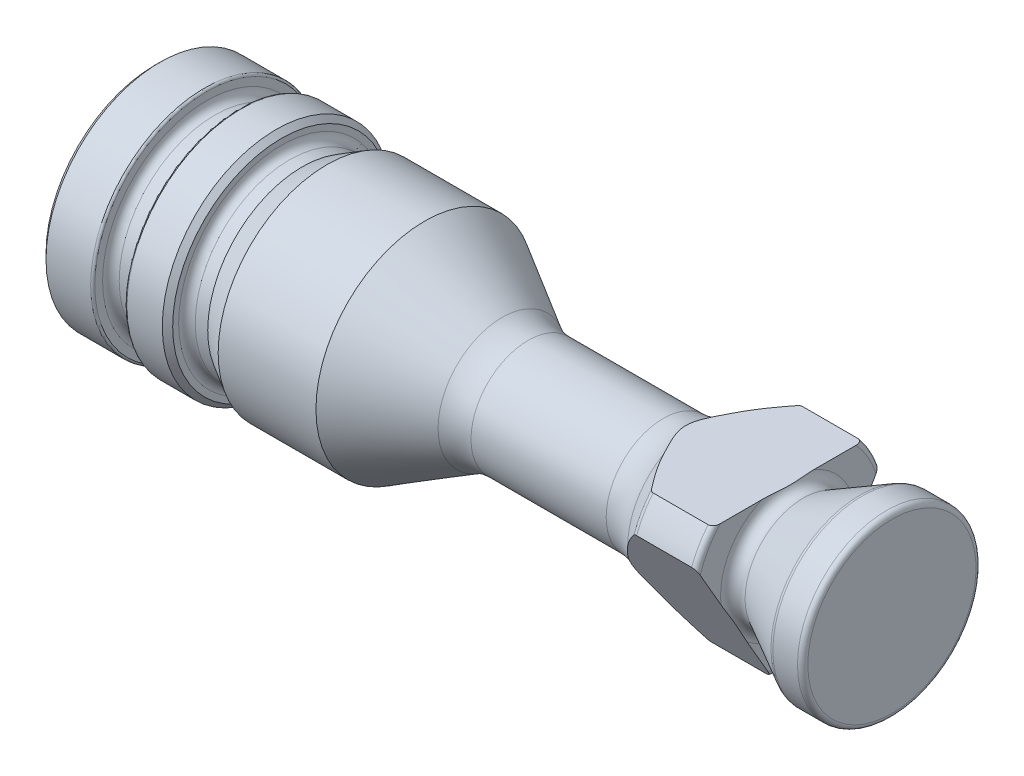
from build123d import *

# Parameters (mm, degrees)
SKETCH2_W          = 10
SKETCH2_H          = 10
CUT_EXTRUDE1_DEPTH = 10
CHAMFER2_SIZE      = 0.5
CHAMFER3_SIZE      = 0.5
SKETCH3_R          = 1.75
CUT_EXTRUDE2_DEPTH = 10
CHAMFER4_SIZE      = 0.5
CUT_EXTRUDE3_DEPTH = 0.01
SKETCH5_W          = 17.172725468
SKETCH5_H          = 6.715014659
CUT_EXTRUDE4_DEPTH = 13
CIRPATTERN1_COUNT  = 3


with BuildPart() as part:
    # Sketch1 → Revolve1 (revolve)
    with BuildSketch(Plane.XY, mode=Mode.PRIVATE) as revolve1_sk:
        with BuildLine():
            Line((33.45669873, 6.169872981), (26, 10.475))
            Line((26, 10.475), (16.58156986, 10.475))
            Line((16.58156986, 10.475), (14.2, 9.1))
            Line((14.2, 9.1), (13, 9.1))
            ThreePointArc((13, 9.1), (12.434314575, 9.334314575), (12.2, 9.9))
            Line((12.2, 9.9), (12.2, 10.975))
            Line((12.2, 10.975), (8.3, 10.975))
            ThreePointArc((8.3, 10.975), (8.158578644, 10.916421356), (8.1, 10.775))
            Line((8.1, 10.775), (8.1, 10.025))
            ThreePointArc((8.1, 10.025), (7.865685425, 9.459314575), (7.3, 9.225))
            Line((7.3, 9.225), (5.8, 9.225))
            ThreePointArc((5.8, 9.225), (5.234314575, 9.459314575), (5, 10.025))
            Line((5, 10.025), (5, 10.775))
            ThreePointArc((5, 10.775), (4.941421356, 10.916421356), (4.8, 10.975))
            Line((4.8, 10.975), (0, 10.975))
            Line((0, 10.975), (0, 0))
            Line((0, 0), (71, 0))
            Line((71, 0), (71, 8.1))
            ThreePointArc((71, 8.1), (70.853553391, 8.453553391), (70.5, 8.6))
            Line((70.5, 8.6), (68.126244748, 8.6))
            ThreePointArc((68.126244748, 8.6), (68.003841388, 8.58478595), (67.888887031, 8.540069669))
            Line((67.888887031, 8.540069669), (62.474715435, 5.619860661))
            ThreePointArc((62.474715435, 5.619860661), (61.487513627, 5.641304642), (61, 6.5))
            Line((61, 6.5), (61, 8.875))
            ThreePointArc((61, 8.875), (60.853553391, 9.228553391), (60.5, 9.375))
            Line((60.5, 9.375), (55.202473207, 9.375))
            ThreePointArc((55.202473207, 9.375), (55.014803358, 9.338443662), (54.854575599, 9.234120111))
            Line((54.854575599, 9.234120111), (52.454244011, 6.908798886))
            ThreePointArc((52.454244011, 6.908798886), (50.85196642, 5.86556338), (48.975267932, 5.5))
            Line((48.975267932, 5.5), (35.95669873, 5.5))
            ThreePointArc((35.95669873, 5.5), (34.662603504, 5.670370869), (33.45669873, 6.169872981))
        make_face()
    revolve(revolve1_sk.sketch.rotate(Axis((71, 0, 0), (1, 0, 0)), 90), axis=Axis((71, 0, 0), (1, 0, 0)))

    # Sketch2 → Cut-Extrude1 (cut)
    with BuildSketch(Plane.ZY):
        Rectangle(SKETCH2_W, SKETCH2_H)
    extrude(amount=-CUT_EXTRUDE1_DEPTH, mode=Mode.SUBTRACT)

    # Chamfer2
    chamfer2_edges = [part.edges().sort_by_distance(p)[0] for p in [
        (0, 0, -10.975),
    ]]
    chamfer(chamfer2_edges, length=CHAMFER2_SIZE)

    # Chamfer3
    chamfer3_edges = [part.edges().sort_by_distance(p)[0] for p in [
        (12.2, 0, -10.975),
    ]]
    chamfer(chamfer3_edges, length=CHAMFER3_SIZE)

    # Sketch3 → Cut-Extrude2 (cut)
    with BuildSketch(Plane.ZY):
        with Locations((3.8, 3.8)):
            Circle(SKETCH3_R)
        with Locations((-3.8, 3.8)):
            Circle(SKETCH3_R)
        with Locations((3.8, -3.8)):
            Circle(SKETCH3_R)
        with Locations((-3.8, -3.8)):
            Circle(SKETCH3_R)
    extrude(amount=-CUT_EXTRUDE2_DEPTH, mode=Mode.SUBTRACT)

    # Chamfer4
    chamfer4_edges = [part.edges().sort_by_distance(p)[0] for p in [
        (0, 0, 5),
        (0, -5.037436867, 5.037436867),
        (0, -5, 0),
        (0, -5.037436867, -5.037436867),
        (0, 5, 0),
        (0, 5.037436867, 5.037436867),
        (0, 0, -5),
        (0, 5.037436867, -5.037436867),
    ]]
    chamfer(chamfer4_edges, length=CHAMFER4_SIZE)

    # Sketch4 → Cut-Extrude3 (cut)
    # profile 1 of 11: a face of its own
    with BuildSketch(Plane.ZY):
        with BuildLine():
            Line((-5.530974171, -6.878354422), (-5.296839556, -6.878354422))
            add(Edge.make_bspline(
                [(-5.296839556, -6.878354422), (-5.285378363, -6.878414679), (-5.26316372, -6.878531473), (-5.230859911, -6.880342832), (-5.200603176, -6.882812662), (-5.17238474, -6.886731551), (-5.146217642, -6.89146016), (-5.122023023, -6.897186497), (-5.099877821, -6.904052764), (-5.073439169, -6.914971489), (-5.043294942, -6.931196576), (-5.010655493, -6.955172084), (-4.982745468, -6.9844975), (-4.958681588, -7.017577267), (-4.939549776, -7.053966675), (-4.925708874, -7.092798397), (-4.916946174, -7.133571565), (-4.916044996, -7.161563512), (-4.915589556, -7.175710191)],
                knots=[0, 0, 0, 0, 1.001505555, 1.941167018, 2.826882275, 3.653841531, 4.429895133, 5.150066043, 5.825578002, 6.45369114, 7.647487171, 8.808567382, 9.977351308, 11.170798116, 12.373658725, 13.556498008, 14.765093433, 16, 16, 16, 16], degree=3))
            add(Edge.make_bspline(
                [(-4.915589556, -7.175710191), (-4.915964374, -7.188962496), (-4.916700926, -7.215004525), (-4.923744158, -7.253093934), (-4.934770672, -7.289351494), (-4.950098186, -7.323644884), (-4.970018871, -7.355199265), (-4.993627437, -7.384269185), (-5.022110912, -7.409623833), (-5.043451452, -7.423798543), (-5.054291479, -7.430998653)],
                knots=[0, 0, 0, 0, 1.044552857, 2.05264487, 3.044412934, 4.028983338, 5.005914585, 5.980388656, 6.974128949, 8, 8, 8, 8], degree=3))
            add(Edge.make_bspline(
                [(-5.054291479, -7.430998653), (-5.040659332, -7.436232367), (-5.014577659, -7.446245758), (-4.978685312, -7.463949346), (-4.947761365, -7.483204926), (-4.921568058, -7.504232989), (-4.899166576, -7.526898867), (-4.879605567, -7.551534906), (-4.862914811, -7.57846248), (-4.848613237, -7.607400835), (-4.837453663, -7.638054482), (-4.82909621, -7.670135891), (-4.824307371, -7.703530024), (-4.823625894, -7.72625644), (-4.823281863, -7.737729422)],
                knots=[0, 0, 0, 0, 1.27268992, 2.434971085, 3.483601985, 4.442670788, 5.356604649, 6.2567628, 7.179492994, 8.113709626, 9.066344395, 10.018646069, 10.999752585, 12, 12, 12, 12], degree=3))
            add(Edge.make_bspline(
                [(-4.823281863, -7.737729422), (-4.823616782, -7.749443778), (-4.824275744, -7.772492102), (-4.829137449, -7.806351005), (-4.837369142, -7.83870813), (-4.848707821, -7.869772764), (-4.863506329, -7.89948481), (-4.881515917, -7.927877929), (-4.902989596, -7.954666842), (-4.927011151, -7.980149228), (-4.954186743, -8.003061612), (-4.983506431, -8.023466997), (-5.015339455, -8.040248504), (-5.049162996, -8.054345426), (-5.085356475, -8.065113608), (-5.123757369, -8.072647062), (-5.164332559, -8.077723074), (-5.192175902, -8.078140402), (-5.20645494, -8.078354422)],
                knots=[0, 0, 0, 0, 0.978564426, 1.925352924, 2.850884081, 3.763762016, 4.682927383, 5.618979971, 6.567305752, 7.547517671, 8.540179244, 9.531824382, 10.526200242, 11.540722885, 12.589160233, 13.674978461, 14.80764778, 16, 16, 16, 16], degree=3))
            Line((-5.20645494, -8.078354422), (-5.530974171, -8.078354422))
            Line((-5.530974171, -8.078354422), (-5.530974171, -6.878354422))
        make_face()
        with BuildLine():
            Line((-5.423281863, -7.001431345), (-5.423281863, -7.38604673))
            Line((-5.423281863, -7.38604673), (-5.350926094, -7.38604673))
            add(Edge.make_bspline(
                [(-5.350926094, -7.38604673), (-5.340349364, -7.385909613), (-5.319912967, -7.385644676), (-5.290317574, -7.384885756), (-5.262846139, -7.382760713), (-5.237546082, -7.38063628), (-5.214457244, -7.377182136), (-5.193630777, -7.373070551), (-5.17473983, -7.368722126), (-5.152954843, -7.361326873), (-5.128244117, -7.350397385), (-5.101901339, -7.333435612), (-5.078678092, -7.313232977), (-5.059067628, -7.28992179), (-5.043017981, -7.264253383), (-5.031870421, -7.23663731), (-5.024311352, -7.207761836), (-5.023628542, -7.187938435), (-5.023281863, -7.177873653)],
                knots=[0, 0, 0, 0, 1.156816544, 2.235205308, 3.236616184, 4.169592532, 5.011045266, 5.787822928, 6.49130361, 7.128639758, 8.301311294, 9.436451833, 10.541879658, 11.654887649, 12.756523258, 13.837046038, 14.901820046, 16, 16, 16, 16], degree=3))
            add(Edge.make_bspline(
                [(-5.023281863, -7.177873653), (-5.023462268, -7.171213388), (-5.023816151, -7.158148552), (-5.026714427, -7.139103059), (-5.031640452, -7.121190915), (-5.037967638, -7.104166649), (-5.046809475, -7.088562586), (-5.057219805, -7.073839205), (-5.069797756, -7.060497907), (-5.084114549, -7.048028365), (-5.100574648, -7.036973098), (-5.119168234, -7.027290551), (-5.140146866, -7.019493713), (-5.163156988, -7.012665318), (-5.188552789, -7.007869331), (-5.216041207, -7.003873884), (-5.245847397, -7.001839801), (-5.266468575, -7.001570534), (-5.277128017, -7.001431345)],
                knots=[0, 0, 0, 0, 0.91205012, 1.789085906, 2.630437955, 3.453916878, 4.269457761, 5.079663411, 5.91843418, 6.774407191, 7.675494373, 8.627863946, 9.638891023, 10.736472738, 11.911756761, 13.175263542, 14.539845004, 16, 16, 16, 16], degree=3))
            Line((-5.277128017, -7.001431345), (-5.423281863, -7.001431345))
        make_face(mode=Mode.SUBTRACT)
        with BuildLine():
            Line((-5.423281863, -7.509123653), (-5.423281863, -7.955277499))
            Line((-5.423281863, -7.955277499), (-5.269916479, -7.955277499))
            add(Edge.make_bspline(
                [(-5.269916479, -7.955277499), (-5.258938561, -7.955145928), (-5.237780073, -7.954892343), (-5.20723108, -7.954064496), (-5.178916873, -7.95218143), (-5.152966655, -7.949217139), (-5.129100214, -7.946001671), (-5.107603858, -7.941677803), (-5.088303335, -7.936723874), (-5.065923572, -7.929066443), (-5.040722369, -7.91717051), (-5.013564361, -7.899234204), (-4.98941823, -7.877866213), (-4.968913569, -7.853135614), (-4.952109116, -7.826244873), (-4.939884389, -7.797737896), (-4.932344666, -7.768085715), (-4.931431922, -7.747868556), (-4.930974171, -7.737729422)],
                knots=[0, 0, 0, 0, 1.160039823, 2.235823828, 3.228722157, 4.157150951, 4.99529583, 5.772374946, 6.472645482, 7.099169577, 8.269452708, 9.405989375, 10.527446681, 11.663510218, 12.788923519, 13.866172445, 14.929861265, 16, 16, 16, 16], degree=3))
            add(Edge.make_bspline(
                [(-4.930974171, -7.737729422), (-4.931068835, -7.731388848), (-4.931256637, -7.718809974), (-4.934088848, -7.700324551), (-4.938207889, -7.682418537), (-4.943532952, -7.665043312), (-4.951288198, -7.648513011), (-4.960341871, -7.632500705), (-4.970957208, -7.616985226), (-4.987498065, -7.597369597), (-5.011557031, -7.574769478), (-5.045742211, -7.552642334), (-5.084612714, -7.534797372), (-5.112804997, -7.527220408), (-5.127368402, -7.523306345)],
                knots=[0, 0, 0, 0, 0.723448775, 1.435228256, 2.130040452, 2.821711965, 3.505591119, 4.210454504, 4.921174351, 5.648778258, 7.137944449, 8.670945889, 10.280296675, 12, 12, 12, 12], degree=3))
            add(Edge.make_bspline(
                [(-5.127368402, -7.523306345), (-5.133206949, -7.522121745), (-5.145866124, -7.519553287), (-5.166508723, -7.516842075), (-5.190075306, -7.514426626), (-5.216620293, -7.512639943), (-5.246177267, -7.510793128), (-5.278809353, -7.510074904), (-5.31438329, -7.509218014), (-5.339066389, -7.509155911), (-5.351887633, -7.509123653)],
                knots=[0, 0, 0, 0, 0.634451884, 1.375622551, 2.216452059, 3.157844607, 4.20941857, 5.370758133, 6.634282058, 8, 8, 8, 8], degree=3))
            Line((-5.351887633, -7.509123653), (-5.423281863, -7.509123653))
        make_face(mode=Mode.SUBTRACT)
    # profile 2 of 11: a face of its own
    with BuildSketch(Plane.ZY):
        with BuildLine():
            Line((-3.454051094, -7.083162114), (-3.546358787, -7.170662114))
            add(Edge.make_bspline(
                [(-3.546358787, -7.170662114), (-3.563062405, -7.154948676), (-3.596071336, -7.123896494), (-3.649886276, -7.08360701), (-3.706033808, -7.049092918), (-3.764220949, -7.02101078), (-3.823006739, -6.998604119), (-3.881610891, -6.982651614), (-3.939432274, -6.972478173), (-3.977889606, -6.971261589), (-3.996839556, -6.970662114)],
                knots=[0, 0, 0, 0, 1.08915593, 2.152340314, 3.188132944, 4.216796309, 5.218260357, 6.173443236, 7.099959455, 8, 8, 8, 8], degree=3))
            add(Edge.make_bspline(
                [(-3.996839556, -6.970662114), (-4.008467453, -6.970803922), (-4.03169309, -6.97108717), (-4.066192042, -6.974702329), (-4.100329175, -6.979901711), (-4.134040046, -6.987424641), (-4.167390201, -6.996959175), (-4.20026365, -7.00888562), (-4.232721715, -7.022790275), (-4.264458657, -7.038857409), (-4.295226829, -7.056507642), (-4.324286316, -7.076067142), (-4.351822338, -7.096909012), (-4.377317341, -7.119555063), (-4.400917977, -7.143800159), (-4.42318599, -7.169193293), (-4.443338206, -7.196428225), (-4.461540891, -7.225003868), (-4.47777916, -7.254418333), (-4.492113555, -7.284388501), (-4.504146843, -7.314814965), (-4.513667799, -7.345735906), (-4.52152288, -7.376912108), (-4.527048917, -7.408559441), (-4.530164365, -7.44071179), (-4.53070326, -7.462242279), (-4.530974171, -7.47306596)],
                knots=[0, 0, 0, 0, 1.02818874, 2.053710826, 3.065248034, 4.081641283, 5.106893873, 6.131558223, 7.173050175, 8.228653731, 9.27666206, 10.308777013, 11.325269123, 12.329503258, 13.32196095, 14.316845687, 15.314881793, 16.315733098, 17.311955233, 18.285320748, 19.252783886, 20.203351036, 21.145449891, 22.095197417, 23.042428769, 24, 24, 24, 24], degree=3))
            add(Edge.make_bspline(
                [(-4.530974171, -7.47306596), (-4.530715068, -7.484130241), (-4.530197568, -7.506228588), (-4.526885459, -7.539209413), (-4.520738634, -7.571700408), (-4.512521133, -7.603808339), (-4.502241997, -7.635588196), (-4.489428511, -7.666902199), (-4.474251734, -7.697749191), (-4.456684916, -7.727851231), (-4.437421075, -7.75717341), (-4.41584059, -7.784793818), (-4.392916961, -7.811080255), (-4.367815053, -7.835449089), (-4.341339781, -7.858552139), (-4.312700144, -7.879752889), (-4.2824593, -7.899459709), (-4.250571113, -7.91742423), (-4.217381588, -7.93347287), (-4.183350701, -7.947743921), (-4.148369736, -7.959496836), (-4.112622528, -7.969075615), (-4.076151692, -7.976927145), (-4.038772102, -7.981978281), (-4.000758602, -7.985643709), (-3.975133928, -7.98591171), (-3.962224171, -7.98604673)],
                knots=[0, 0, 0, 0, 0.93586088, 1.869166235, 2.799637598, 3.729985548, 4.670839027, 5.622275134, 6.589130586, 7.576015415, 8.568469353, 9.55398029, 10.53834874, 11.515998671, 12.510579167, 13.508179873, 14.527009472, 15.561807829, 16.601455013, 17.643573243, 18.680854198, 19.719860599, 20.772568776, 21.833555941, 22.908541556, 24, 24, 24, 24], degree=3))
            add(Edge.make_bspline(
                [(-3.962224171, -7.98604673), (-3.946665881, -7.985721503), (-3.91611465, -7.985082869), (-3.871205012, -7.980111341), (-3.828072531, -7.972346726), (-3.786838404, -7.960975562), (-3.74745474, -7.946471445), (-3.70977716, -7.928987312), (-3.674102305, -7.907852549), (-3.640322932, -7.883998652), (-3.609206182, -7.857422138), (-3.581141911, -7.828744039), (-3.556577743, -7.798103559), (-3.535147561, -7.765681165), (-3.517418879, -7.731208489), (-3.502867064, -7.694854468), (-3.491712792, -7.656602749), (-3.487133944, -7.630171333), (-3.484820325, -7.61681596)],
                knots=[0, 0, 0, 0, 1.13008108, 2.219097802, 3.278683437, 4.311054135, 5.322181354, 6.324827112, 7.324222904, 8.330512327, 9.32562643, 10.293043162, 11.24128371, 12.174520618, 13.111833804, 14.052305215, 15.015860969, 16, 16, 16, 16], degree=3))
            Line((-3.484820325, -7.61681596), (-3.884820325, -7.61681596))
            Line((-3.884820325, -7.61681596), (-3.884820325, -7.493739037))
            Line((-3.884820325, -7.493739037), (-3.377128017, -7.493739037))
            add(Edge.make_bspline(
                [(-3.377128017, -7.493739037), (-3.37771288, -7.516678748), (-3.378857561, -7.561575905), (-3.386886903, -7.627051426), (-3.399852565, -7.68889315), (-3.417564672, -7.747166203), (-3.440493339, -7.801788006), (-3.468392492, -7.852814017), (-3.501708647, -7.899914594), (-3.539255085, -7.943474252), (-3.581392213, -7.982329982), (-3.626981454, -8.016480589), (-3.676098129, -8.0452472), (-3.728695777, -8.068650856), (-3.784602212, -8.086916226), (-3.843946799, -8.09986648), (-3.906649062, -8.107625325), (-3.949621637, -8.108616655), (-3.971599171, -8.109123653)],
                knots=[0, 0, 0, 0, 1.140356446, 2.231883559, 3.274166699, 4.278491846, 5.25512956, 6.21435461, 7.1637429, 8.11826594, 9.068280886, 10.0076534, 10.945064095, 11.891975133, 12.864533718, 13.863980011, 14.907571808, 16, 16, 16, 16], degree=3))
            add(Edge.make_bspline(
                [(-3.971599171, -8.109123653), (-3.985145503, -8.108928525), (-4.011863236, -8.108543672), (-4.051322983, -8.105808581), (-4.089694739, -8.101598098), (-4.126972913, -8.09523977), (-4.16329463, -8.087451888), (-4.198478488, -8.077479299), (-4.232658514, -8.065935745), (-4.265887537, -8.0528058), (-4.297863954, -8.03759266), (-4.328730188, -8.020686498), (-4.35865686, -8.002174489), (-4.387440116, -7.981736484), (-4.415229929, -7.959525355), (-4.44184711, -7.935496583), (-4.467440668, -7.909723628), (-4.483472827, -7.891422253), (-4.491551094, -7.882200576)],
                knots=[0, 0, 0, 0, 1.107784379, 2.184907829, 3.233506516, 4.263428166, 5.276301166, 6.270063455, 7.25232949, 8.225834625, 9.190232166, 10.146266622, 11.1027726, 12.066435141, 13.031522626, 14.010570082, 14.99756817, 16, 16, 16, 16], degree=3))
            add(Edge.make_bspline(
                [(-4.491551094, -7.882200576), (-4.503271985, -7.867570638), (-4.526519212, -7.838553603), (-4.556443152, -7.792062194), (-4.581952204, -7.743924413), (-4.602649743, -7.694006255), (-4.618811373, -7.64235441), (-4.630402088, -7.589034882), (-4.637193159, -7.533979009), (-4.638171514, -7.496722346), (-4.638666479, -7.477873653)],
                knots=[0, 0, 0, 0, 1.023165419, 2.029347347, 3.013907458, 3.994755782, 4.975994455, 5.96558838, 6.970761222, 8, 8, 8, 8], degree=3))
            add(Edge.make_bspline(
                [(-4.638666479, -7.477873653), (-4.638483997, -7.463759509), (-4.638121353, -7.435710604), (-4.633724033, -7.394068098), (-4.627414976, -7.353165004), (-4.6181417, -7.313034756), (-4.606451552, -7.273650553), (-4.591861785, -7.234994108), (-4.574874964, -7.197042609), (-4.555131365, -7.160057283), (-4.53315955, -7.124528913), (-4.509313761, -7.090600523), (-4.483255383, -7.058889987), (-4.455409966, -7.028995707), (-4.425445284, -7.001293246), (-4.393642053, -6.975526122), (-4.359975764, -6.951659772), (-4.324340502, -6.930070115), (-4.287268153, -6.910676874), (-4.248847582, -6.893674858), (-4.209090515, -6.879623436), (-4.168294808, -6.867700997), (-4.126151665, -6.858884377), (-4.08296691, -6.852490522), (-4.038515443, -6.848115459), (-4.008468804, -6.8477636), (-3.993233787, -6.847585191)],
                knots=[0, 0, 0, 0, 1.008945113, 2.00506715, 2.99143336, 3.967273523, 4.948097931, 5.927297278, 6.919902385, 7.919676788, 8.923139349, 9.905703106, 10.883022732, 11.856032218, 12.825136022, 13.798837087, 14.781400844, 15.773989409, 16.776158564, 17.77167057, 18.775803737, 19.789618931, 20.80898985, 21.851988756, 22.910860228, 24, 24, 24, 24], degree=3))
            add(Edge.make_bspline(
                [(-3.993233787, -6.847585191), (-3.980809246, -6.847783874), (-3.956172842, -6.848177839), (-3.919512591, -6.850908575), (-3.883418986, -6.855236763), (-3.847838509, -6.86114309), (-3.812892326, -6.869187784), (-3.778480885, -6.878814624), (-3.744554301, -6.890023249), (-3.711218901, -6.903390854), (-3.678250541, -6.918563525), (-3.64546591, -6.935642413), (-3.612977026, -6.954919557), (-3.580727546, -6.976452198), (-3.548514109, -6.999870513), (-3.516846232, -7.025844281), (-3.484959508, -7.053349226), (-3.464456029, -7.073125974), (-3.454051094, -7.083162114)],
                knots=[0, 0, 0, 0, 0.985871117, 1.954866573, 2.915460327, 3.869826059, 4.81536089, 5.759505086, 6.70452669, 7.649098992, 8.607881297, 9.583363685, 10.581137262, 11.603961102, 12.659522466, 13.73993555, 14.853081303, 16, 16, 16, 16], degree=3))
        make_face()
    # profile 3 of 11: a face of its own
    with BuildSketch(Plane.ZY):
        with BuildLine():
            add(Edge.make_bspline(
                [(-2.777128017, -7.478835191), (-2.777015554, -7.459601801), (-2.776797092, -7.422240664), (-2.774366776, -7.367800215), (-2.770329516, -7.316728116), (-2.764796703, -7.269021922), (-2.758063681, -7.224669317), (-2.749075514, -7.183788829), (-2.738853982, -7.146191249), (-2.727007429, -7.111753975), (-2.713640187, -7.080013049), (-2.699091298, -7.050381551), (-2.682783368, -7.022904317), (-2.665648426, -6.997142789), (-2.646992859, -6.973518665), (-2.627347559, -6.951698324), (-2.605945773, -6.932186066), (-2.583515028, -6.914410191), (-2.55985224, -6.898827515), (-2.535631897, -6.885102005), (-2.510687289, -6.873376336), (-2.484950312, -6.864156758), (-2.458652293, -6.856541611), (-2.431701298, -6.851333971), (-2.404052831, -6.848057317), (-2.385390624, -6.84774406), (-2.375926094, -6.847585191)],
                knots=[0, 0, 0, 0, 1.646270934, 3.197905019, 4.663502075, 6.030701355, 7.308322542, 8.50163776, 9.611534131, 10.641858119, 11.616356847, 12.558055219, 13.465016945, 14.349605745, 15.204443733, 16.039544428, 16.859896111, 17.680448484, 18.487036065, 19.28249412, 20.06191084, 20.843045899, 21.620316918, 22.403196591, 23.190181807, 24, 24, 24, 24], degree=3))
            add(Edge.make_bspline(
                [(-2.375926094, -6.847585191), (-2.366382502, -6.847752442), (-2.347403299, -6.848085052), (-2.319343741, -6.851281832), (-2.291932422, -6.856586217), (-2.265286203, -6.86410198), (-2.239186208, -6.873426212), (-2.213836582, -6.885113223), (-2.189079868, -6.898717406), (-2.165309484, -6.914702736), (-2.142264473, -6.93252523), (-2.120510886, -6.952672431), (-2.100046742, -6.974940906), (-2.080615209, -6.999092402), (-2.062767575, -7.025590146), (-2.04577097, -7.053973269), (-2.030557701, -7.084738137), (-2.015905812, -7.11737144), (-2.003258845, -7.152776123), (-1.991853275, -7.190752613), (-1.982637629, -7.231749477), (-1.974961307, -7.275551618), (-1.969014486, -7.322319898), (-1.964683294, -7.371954063), (-1.962395379, -7.424486769), (-1.96196451, -7.460403746), (-1.961743402, -7.478835191)],
                knots=[0, 0, 0, 0, 0.810914788, 1.612654377, 2.396697861, 3.181598691, 3.963628158, 4.749916497, 5.551656086, 6.361998678, 7.18212741, 8.025565596, 8.878627764, 9.750805457, 10.657531673, 11.591944965, 12.560506719, 13.57287815, 14.630710178, 15.753379473, 16.941251878, 18.199788006, 19.531962791, 20.947069417, 22.433333509, 24, 24, 24, 24], degree=3))
            add(Edge.make_bspline(
                [(-1.961743402, -7.478835191), (-1.961966802, -7.497186245), (-1.962402089, -7.532942526), (-1.964657646, -7.58523886), (-1.969100605, -7.634609618), (-1.974658315, -7.681173205), (-1.982355788, -7.724735817), (-1.991820417, -7.7654482), (-2.002329099, -7.803486167), (-2.015301028, -7.838538103), (-2.029498986, -7.871092979), (-2.044946482, -7.901493144), (-2.061496136, -7.930007302), (-2.079526563, -7.956407215), (-2.098744876, -7.980879897), (-2.119562404, -8.002993368), (-2.141392319, -8.023280455), (-2.164505147, -8.041332442), (-2.18864625, -8.057132946), (-2.213317934, -8.071263409), (-2.238957951, -8.082657476), (-2.264985249, -8.092440919), (-2.291772117, -8.09991536), (-2.319285166, -8.105083539), (-2.347384447, -8.108708172), (-2.366379269, -8.10898468), (-2.375926094, -8.109123653)],
                knots=[0, 0, 0, 0, 1.561518951, 3.042555995, 4.452378317, 5.7783523, 7.031515105, 8.214008947, 9.334062868, 10.386615937, 11.391082383, 12.354592575, 13.286541444, 14.194233754, 15.072674879, 15.931287219, 16.775624067, 17.606195743, 18.42308326, 19.229000347, 20.022332153, 20.807536673, 21.593273796, 22.3848459, 23.188221202, 24, 24, 24, 24], degree=3))
            add(Edge.make_bspline(
                [(-2.375926094, -8.109123653), (-2.385390362, -8.108963759), (-2.40405205, -8.108648481), (-2.431704311, -8.10538663), (-2.458544005, -8.100142458), (-2.484703578, -8.092799622), (-2.510317241, -8.083811678), (-2.535035967, -8.072101844), (-2.559134602, -8.058615877), (-2.58254885, -8.043257447), (-2.604838733, -8.025661441), (-2.626129684, -8.0061994), (-2.645886833, -7.984385659), (-2.664275666, -7.960564656), (-2.681752496, -7.934955545), (-2.697828853, -7.907208674), (-2.71269886, -7.877434065), (-2.726290914, -7.845439352), (-2.738341884, -7.810757663), (-2.748986813, -7.77299223), (-2.757391667, -7.731809726), (-2.764585823, -7.687540915), (-2.770388468, -7.639995567), (-2.774349951, -7.589147872), (-2.776798402, -7.535029515), (-2.777016141, -7.497908449), (-2.777128017, -7.478835191)],
                knots=[0, 0, 0, 0, 0.810891512, 1.598919785, 2.382837074, 3.152667961, 3.926044502, 4.706494248, 5.493654104, 6.291793342, 7.103789334, 7.925228297, 8.761435821, 9.622817696, 10.50288917, 11.416980706, 12.369136599, 13.353924996, 14.394355917, 15.514179734, 16.714354668, 17.994756427, 19.357759367, 20.818452758, 22.365282078, 24, 24, 24, 24], degree=3))
        make_face()
        with BuildLine():
            add(Edge.make_bspline(
                [(-2.66943571, -7.478354422), (-2.669394756, -7.494382547), (-2.669315274, -7.525489991), (-2.667238862, -7.570693395), (-2.664410211, -7.612854651), (-2.660761767, -7.652027292), (-2.655343613, -7.688078724), (-2.649272714, -7.721256902), (-2.641884798, -7.75138624), (-2.633143649, -7.778673489), (-2.623187387, -7.803581741), (-2.612316805, -7.826759301), (-2.600638843, -7.848479965), (-2.58756942, -7.868548631), (-2.573335684, -7.887030744), (-2.558259138, -7.904253429), (-2.541777109, -7.919612394), (-2.518975826, -7.93803303), (-2.488874178, -7.957068162), (-2.450947164, -7.973643964), (-2.411975124, -7.984060806), (-2.385523267, -7.985385523), (-2.372320325, -7.98604673)],
                knots=[0, 0, 0, 0, 1.459021318, 2.831673884, 4.118529203, 5.306027144, 6.411944654, 7.436330062, 8.375795394, 9.233974572, 10.042671642, 10.816086306, 11.563610507, 12.285937304, 12.993564865, 13.685989202, 14.367179055, 15.041617293, 16.353048772, 17.594441528, 18.799311195, 20, 20, 20, 20], degree=3))
            add(Edge.make_bspline(
                [(-2.372320325, -7.98604673), (-2.35903198, -7.985498919), (-2.332482727, -7.984404429), (-2.293693997, -7.973844862), (-2.256037904, -7.957912448), (-2.226527525, -7.939073304), (-2.204076367, -7.921132162), (-2.187990542, -7.905835711), (-2.173226411, -7.888707985), (-2.159223414, -7.870228227), (-2.146380302, -7.850043375), (-2.134701512, -7.828250492), (-2.124044364, -7.80478906), (-2.117972692, -7.788410863), (-2.114868402, -7.780037114)],
                knots=[0, 0, 0, 0, 1.353760809, 2.704726607, 4.075137775, 5.516104923, 6.260822281, 7.007110065, 7.778089737, 8.566572457, 9.372053459, 10.217411131, 11.088608312, 12, 12, 12, 12], degree=3))
            add(Edge.make_bspline(
                [(-2.114868402, -7.780037114), (-2.111250653, -7.769329775), (-2.103905071, -7.747589284), (-2.094438177, -7.713864604), (-2.086982612, -7.678480799), (-2.080275172, -7.64164933), (-2.075696981, -7.603098576), (-2.072012017, -7.562947816), (-2.069841496, -7.521166777), (-2.069572438, -7.492779923), (-2.06943571, -7.478354422)],
                knots=[0, 0, 0, 0, 0.884706709, 1.796334032, 2.740027952, 3.714592787, 4.726048262, 5.777819803, 6.87074269, 8, 8, 8, 8], degree=3))
            add(Edge.make_bspline(
                [(-2.06943571, -7.478354422), (-2.069624346, -7.463931254), (-2.069993359, -7.435716455), (-2.071403869, -7.394395936), (-2.075046237, -7.355149846), (-2.07909165, -7.317809113), (-2.085056411, -7.282580438), (-2.091487659, -7.249168904), (-2.100128075, -7.217988439), (-2.109357712, -7.188550868), (-2.119921276, -7.161190643), (-2.131549528, -7.135780202), (-2.143968417, -7.112196868), (-2.157457185, -7.090505345), (-2.171855705, -7.070608474), (-2.187544007, -7.052905184), (-2.203899792, -7.036846795), (-2.226808542, -7.018516771), (-2.256799727, -6.999827047), (-2.294118234, -6.982627358), (-2.332953884, -6.972750229), (-2.359207639, -6.971357651), (-2.372320325, -6.970662114)],
                knots=[0, 0, 0, 0, 1.31362396, 2.569729283, 3.763502607, 4.902122613, 5.988968491, 7.01645872, 7.998833611, 8.933434873, 9.825090667, 10.667526885, 11.477055099, 12.250526234, 12.991942729, 13.710640831, 14.402115721, 15.076753259, 16.378508321, 17.609869233, 18.806226677, 20, 20, 20, 20], degree=3))
            add(Edge.make_bspline(
                [(-2.372320325, -6.970662114), (-2.385592528, -6.97135861), (-2.412161113, -6.972752871), (-2.451400412, -6.982590558), (-2.489013332, -6.999737861), (-2.518925209, -7.018578674), (-2.541849936, -7.036523238), (-2.557992574, -7.052084308), (-2.573128404, -7.069105881), (-2.587071616, -7.087757966), (-2.600130798, -7.107803235), (-2.612124288, -7.129399383), (-2.62293023, -7.15265585), (-2.632902071, -7.177552914), (-2.641669884, -7.204837809), (-2.6489021, -7.234930036), (-2.655583375, -7.268002684), (-2.660313182, -7.304249373), (-2.664517898, -7.343431825), (-2.667220075, -7.385698334), (-2.66932222, -7.43097755), (-2.669397122, -7.462245833), (-2.66943571, -7.478354422)],
                knots=[0, 0, 0, 0, 1.207732386, 2.417664972, 3.655092373, 4.956220595, 5.625982001, 6.301752483, 6.994047911, 7.697131622, 8.419323945, 9.170223765, 9.943494443, 10.752040957, 11.610060368, 12.549350801, 13.567764191, 14.679664412, 15.874934091, 17.154273443, 18.533957287, 20, 20, 20, 20], degree=3))
        make_face(mode=Mode.SUBTRACT)
    # profile 4 of 11: a face of its own
    with BuildSketch(Plane.ZY):
        with BuildLine():
            add(Edge.make_bspline(
                [(-1.854051094, -7.478835191), (-1.853938631, -7.459601801), (-1.853720169, -7.422240664), (-1.851289853, -7.367800215), (-1.847252593, -7.316728116), (-1.84171978, -7.269021922), (-1.834986758, -7.224669317), (-1.825998591, -7.183788829), (-1.815777059, -7.146191249), (-1.803930506, -7.111753975), (-1.790563264, -7.080013049), (-1.776014374, -7.050381551), (-1.759706445, -7.022904317), (-1.742571503, -6.997142789), (-1.723915936, -6.973518665), (-1.704270636, -6.951698324), (-1.68286885, -6.932186066), (-1.660438105, -6.914410191), (-1.636775317, -6.898827515), (-1.612554974, -6.885102005), (-1.587610366, -6.873376336), (-1.561873389, -6.864156758), (-1.53557537, -6.856541611), (-1.508624375, -6.851333971), (-1.480975908, -6.848057317), (-1.462313701, -6.84774406), (-1.452849171, -6.847585191)],
                knots=[0, 0, 0, 0, 1.646270934, 3.197905019, 4.663502075, 6.030701355, 7.308322542, 8.50163776, 9.611534131, 10.641858119, 11.616356847, 12.558055219, 13.465016945, 14.349605745, 15.204443733, 16.039544428, 16.859896111, 17.680448484, 18.487036065, 19.28249412, 20.06191084, 20.843045899, 21.620316918, 22.403196591, 23.190181807, 24, 24, 24, 24], degree=3))
            add(Edge.make_bspline(
                [(-1.452849171, -6.847585191), (-1.443305579, -6.847752442), (-1.424326375, -6.848085052), (-1.396266818, -6.851281832), (-1.368855499, -6.856586217), (-1.34220928, -6.86410198), (-1.316109284, -6.873426212), (-1.290759659, -6.885113223), (-1.266002945, -6.898717406), (-1.242232561, -6.914702736), (-1.21918755, -6.93252523), (-1.197433963, -6.952672431), (-1.176969819, -6.974940906), (-1.157538286, -6.999092402), (-1.139690652, -7.025590146), (-1.122694047, -7.053973269), (-1.107480778, -7.084738137), (-1.092828889, -7.11737144), (-1.080181922, -7.152776123), (-1.068776352, -7.190752613), (-1.059560706, -7.231749477), (-1.051884384, -7.275551618), (-1.045937562, -7.322319898), (-1.041606371, -7.371954063), (-1.039318456, -7.424486769), (-1.038887587, -7.460403746), (-1.038666479, -7.478835191)],
                knots=[0, 0, 0, 0, 0.810914788, 1.612654377, 2.396697861, 3.181598691, 3.963628158, 4.749916497, 5.551656086, 6.361998678, 7.18212741, 8.025565596, 8.878627764, 9.750805457, 10.657531673, 11.591944965, 12.560506719, 13.57287815, 14.630710178, 15.753379473, 16.941251878, 18.199788006, 19.531962791, 20.947069417, 22.433333509, 24, 24, 24, 24], degree=3))
            add(Edge.make_bspline(
                [(-1.038666479, -7.478835191), (-1.038889879, -7.497186245), (-1.039325166, -7.532942526), (-1.041580722, -7.58523886), (-1.046023682, -7.634609618), (-1.051581392, -7.681173205), (-1.059278865, -7.724735817), (-1.068743493, -7.7654482), (-1.079252176, -7.803486167), (-1.092224105, -7.838538103), (-1.106422063, -7.871092979), (-1.121869559, -7.901493144), (-1.138419213, -7.930007302), (-1.15644964, -7.956407215), (-1.175667953, -7.980879897), (-1.196485481, -8.002993368), (-1.218315396, -8.023280455), (-1.241428224, -8.041332442), (-1.265569327, -8.057132946), (-1.290241011, -8.071263409), (-1.315881028, -8.082657476), (-1.341908326, -8.092440919), (-1.368695194, -8.09991536), (-1.396208243, -8.105083539), (-1.424307524, -8.108708172), (-1.443302346, -8.10898468), (-1.452849171, -8.109123653)],
                knots=[0, 0, 0, 0, 1.561518951, 3.042555995, 4.452378317, 5.7783523, 7.031515105, 8.214008947, 9.334062868, 10.386615937, 11.391082383, 12.354592575, 13.286541444, 14.194233754, 15.072674879, 15.931287219, 16.775624067, 17.606195743, 18.42308326, 19.229000347, 20.022332153, 20.807536673, 21.593273796, 22.3848459, 23.188221202, 24, 24, 24, 24], degree=3))
            add(Edge.make_bspline(
                [(-1.452849171, -8.109123653), (-1.462313439, -8.108963759), (-1.480975127, -8.108648481), (-1.508627387, -8.10538663), (-1.535467082, -8.100142458), (-1.561626655, -8.092799622), (-1.587240317, -8.083811678), (-1.611959044, -8.072101844), (-1.636057679, -8.058615877), (-1.659471926, -8.043257447), (-1.68176181, -8.025661441), (-1.703052761, -8.0061994), (-1.72280991, -7.984385659), (-1.741198743, -7.960564656), (-1.758675573, -7.934955545), (-1.77475193, -7.907208674), (-1.789621937, -7.877434065), (-1.803213991, -7.845439352), (-1.815264961, -7.810757663), (-1.82590989, -7.77299223), (-1.834314744, -7.731809726), (-1.8415089, -7.687540915), (-1.847311545, -7.639995567), (-1.851273028, -7.589147872), (-1.853721479, -7.535029515), (-1.853939218, -7.497908449), (-1.854051094, -7.478835191)],
                knots=[0, 0, 0, 0, 0.810891512, 1.598919785, 2.382837074, 3.152667961, 3.926044502, 4.706494248, 5.493654104, 6.291793342, 7.103789334, 7.925228297, 8.761435821, 9.622817696, 10.50288917, 11.416980706, 12.369136599, 13.353924996, 14.394355917, 15.514179734, 16.714354668, 17.994756427, 19.357759367, 20.818452758, 22.365282078, 24, 24, 24, 24], degree=3))
        make_face()
        with BuildLine():
            add(Edge.make_bspline(
                [(-1.746358787, -7.478354422), (-1.746317833, -7.494382547), (-1.746238351, -7.525489991), (-1.744161939, -7.570693395), (-1.741333288, -7.612854651), (-1.737684844, -7.652027292), (-1.73226669, -7.688078724), (-1.726195791, -7.721256902), (-1.718807875, -7.75138624), (-1.710066726, -7.778673489), (-1.700110464, -7.803581741), (-1.689239882, -7.826759301), (-1.67756192, -7.848479965), (-1.664492497, -7.868548631), (-1.650258761, -7.887030744), (-1.635182215, -7.904253429), (-1.618700186, -7.919612394), (-1.595898903, -7.93803303), (-1.565797255, -7.957068162), (-1.527870241, -7.973643964), (-1.488898201, -7.984060806), (-1.462446344, -7.985385523), (-1.449243402, -7.98604673)],
                knots=[0, 0, 0, 0, 1.459021318, 2.831673884, 4.118529203, 5.306027144, 6.411944654, 7.436330062, 8.375795394, 9.233974572, 10.042671642, 10.816086306, 11.563610507, 12.285937304, 12.993564865, 13.685989202, 14.367179055, 15.041617293, 16.353048772, 17.594441528, 18.799311195, 20, 20, 20, 20], degree=3))
            add(Edge.make_bspline(
                [(-1.449243402, -7.98604673), (-1.435955057, -7.985498919), (-1.409405804, -7.984404429), (-1.370617074, -7.973844862), (-1.332960981, -7.957912448), (-1.303450602, -7.939073304), (-1.280999444, -7.921132162), (-1.264913619, -7.905835711), (-1.250149488, -7.888707985), (-1.236146491, -7.870228227), (-1.223303379, -7.850043375), (-1.211624589, -7.828250492), (-1.200967441, -7.80478906), (-1.194895769, -7.788410863), (-1.191791479, -7.780037114)],
                knots=[0, 0, 0, 0, 1.353760809, 2.704726607, 4.075137775, 5.516104923, 6.260822281, 7.007110065, 7.778089737, 8.566572457, 9.372053459, 10.217411131, 11.088608312, 12, 12, 12, 12], degree=3))
            add(Edge.make_bspline(
                [(-1.191791479, -7.780037114), (-1.18817373, -7.769329775), (-1.180828148, -7.747589284), (-1.171361254, -7.713864604), (-1.163905689, -7.678480799), (-1.157198249, -7.64164933), (-1.152620058, -7.603098576), (-1.148935094, -7.562947816), (-1.146764572, -7.521166777), (-1.146495515, -7.492779923), (-1.146358787, -7.478354422)],
                knots=[0, 0, 0, 0, 0.884706709, 1.796334032, 2.740027952, 3.714592787, 4.726048262, 5.777819803, 6.87074269, 8, 8, 8, 8], degree=3))
            add(Edge.make_bspline(
                [(-1.146358787, -7.478354422), (-1.146547423, -7.463931254), (-1.146916436, -7.435716455), (-1.148326946, -7.394395936), (-1.151969314, -7.355149846), (-1.156014726, -7.317809113), (-1.161979488, -7.282580438), (-1.168410736, -7.249168904), (-1.177051152, -7.217988439), (-1.186280789, -7.188550868), (-1.196844353, -7.161190643), (-1.208472605, -7.135780202), (-1.220891493, -7.112196868), (-1.234380262, -7.090505345), (-1.248778782, -7.070608474), (-1.264467084, -7.052905184), (-1.280822869, -7.036846795), (-1.303731618, -7.018516771), (-1.333722804, -6.999827047), (-1.371041311, -6.982627358), (-1.409876961, -6.972750229), (-1.436130716, -6.971357651), (-1.449243402, -6.970662114)],
                knots=[0, 0, 0, 0, 1.31362396, 2.569729283, 3.763502607, 4.902122613, 5.988968491, 7.01645872, 7.998833611, 8.933434873, 9.825090667, 10.667526885, 11.477055099, 12.250526234, 12.991942729, 13.710640831, 14.402115721, 15.076753259, 16.378508321, 17.609869233, 18.806226677, 20, 20, 20, 20], degree=3))
            add(Edge.make_bspline(
                [(-1.449243402, -6.970662114), (-1.462515605, -6.97135861), (-1.48908419, -6.972752871), (-1.528323488, -6.982590558), (-1.565936409, -6.999737861), (-1.595848286, -7.018578674), (-1.618773013, -7.036523238), (-1.634915651, -7.052084308), (-1.650051481, -7.069105881), (-1.663994693, -7.087757966), (-1.677053875, -7.107803235), (-1.689047365, -7.129399383), (-1.699853307, -7.15265585), (-1.709825148, -7.177552914), (-1.718592961, -7.204837809), (-1.725825177, -7.234930036), (-1.732506452, -7.268002684), (-1.737236259, -7.304249373), (-1.741440975, -7.343431825), (-1.744143151, -7.385698334), (-1.746245297, -7.43097755), (-1.746320199, -7.462245833), (-1.746358787, -7.478354422)],
                knots=[0, 0, 0, 0, 1.207732386, 2.417664972, 3.655092373, 4.956220595, 5.625982001, 6.301752483, 6.994047911, 7.697131622, 8.419323945, 9.170223765, 9.943494443, 10.752040957, 11.610060368, 12.549350801, 13.567764191, 14.679664412, 15.874934091, 17.154273443, 18.533957287, 20, 20, 20, 20], degree=3))
        make_face(mode=Mode.SUBTRACT)
    # profile 5 of 11: a face of its own
    with BuildSketch(Plane.ZY):
        with BuildLine():
            add(Edge.make_bspline(
                [(-0.34756071, -7.409844807), (-0.337738351, -7.414966391), (-0.31858147, -7.424955192), (-0.291297856, -7.441038905), (-0.26636357, -7.457990093), (-0.243086806, -7.475008102), (-0.221876514, -7.492744668), (-0.202969858, -7.511270321), (-0.185899817, -7.530122646), (-0.171010634, -7.549620876), (-0.157914576, -7.569713213), (-0.146596129, -7.590452393), (-0.13692166, -7.611792964), (-0.129254366, -7.633967877), (-0.122938324, -7.656651396), (-0.118592402, -7.680136418), (-0.116255173, -7.704268192), (-0.115813294, -7.720577324), (-0.115589556, -7.728835191)],
                knots=[0, 0, 0, 0, 1.272397273, 2.481599622, 3.635517121, 4.734568067, 5.792894095, 6.808321871, 7.773003508, 8.711915296, 9.623354172, 10.525449501, 11.423591555, 12.311487226, 13.218079475, 14.126165749, 15.051214107, 16, 16, 16, 16], degree=3))
            add(Edge.make_bspline(
                [(-0.115589556, -7.728835191), (-0.115854043, -7.7403887), (-0.116377562, -7.763257428), (-0.120937556, -7.79701038), (-0.127764863, -7.829791562), (-0.137734982, -7.861593788), (-0.150665287, -7.892241573), (-0.166600202, -7.921761152), (-0.18463833, -7.950636344), (-0.199124812, -7.968402996), (-0.20645494, -7.977392883)],
                knots=[0, 0, 0, 0, 1.025265484, 2.029385089, 3.018602448, 3.995076438, 4.983346944, 5.966715145, 6.97116228, 8, 8, 8, 8], degree=3))
            add(Edge.make_bspline(
                [(-0.20645494, -7.977392883), (-0.215998874, -7.987882177), (-0.234968805, -8.008731146), (-0.267465809, -8.035799996), (-0.303130455, -8.058548359), (-0.341824741, -8.077087295), (-0.383445232, -8.091516732), (-0.427983063, -8.101885595), (-0.475525058, -8.107824714), (-0.508201219, -8.108683224), (-0.524964556, -8.109123653)],
                knots=[0, 0, 0, 0, 0.954267603, 1.896743057, 2.838368354, 3.796610408, 4.779680527, 5.799409237, 6.871065594, 8, 8, 8, 8], degree=3))
            add(Edge.make_bspline(
                [(-0.524964556, -8.109123653), (-0.541083432, -8.108728517), (-0.572449128, -8.107959624), (-0.618103257, -8.102750105), (-0.660659738, -8.093620551), (-0.700366013, -8.081125256), (-0.736982708, -8.064870321), (-0.770405485, -8.044638866), (-0.801116561, -8.021245229), (-0.828183924, -7.994017545), (-0.852214247, -7.964854846), (-0.873323294, -7.93476858), (-0.890868693, -7.903756), (-0.905723697, -7.872279531), (-0.91709559, -7.839897993), (-0.924971777, -7.806777988), (-0.929973827, -7.772977368), (-0.930639359, -7.750166515), (-0.930974171, -7.73869096)],
                knots=[0, 0, 0, 0, 1.256902934, 2.445805442, 3.576955095, 4.645999104, 5.686449165, 6.692658513, 7.68621702, 8.689161843, 9.678783111, 10.630372946, 11.551080876, 12.453998257, 13.34127905, 14.221779781, 15.105423033, 16, 16, 16, 16], degree=3))
            add(Edge.make_bspline(
                [(-0.930974171, -7.73869096), (-0.930776041, -7.730270666), (-0.930384464, -7.713629192), (-0.927674231, -7.689043137), (-0.923317044, -7.665113033), (-0.917399516, -7.641750493), (-0.909379735, -7.619125599), (-0.899696718, -7.597131151), (-0.888405763, -7.575742317), (-0.875349364, -7.554842129), (-0.860160098, -7.53472344), (-0.842961133, -7.515044813), (-0.823408721, -7.496111601), (-0.80172038, -7.477692484), (-0.778143967, -7.459460722), (-0.752067099, -7.442401615), (-0.724181065, -7.425307455), (-0.704362068, -7.415087458), (-0.694195325, -7.409844807)],
                knots=[0, 0, 0, 0, 0.941657376, 1.861047343, 2.762797495, 3.66048619, 4.553285746, 5.444104102, 6.34607688, 7.256116206, 8.197091036, 9.162375105, 10.176350973, 11.237807142, 12.343728897, 13.50695164, 14.721116704, 16, 16, 16, 16], degree=3))
            add(Edge.make_bspline(
                [(-0.694195325, -7.409844807), (-0.708112368, -7.402255743), (-0.735059658, -7.387561192), (-0.770740609, -7.360562287), (-0.801388823, -7.33132075), (-0.826161869, -7.299219106), (-0.845660919, -7.265260178), (-0.859038726, -7.229656434), (-0.868088949, -7.193068053), (-0.868985461, -7.168071642), (-0.86943571, -7.155517883)],
                knots=[0, 0, 0, 0, 1.166880483, 2.259407225, 3.286803203, 4.280235371, 5.237608625, 6.161067461, 7.076446754, 8, 8, 8, 8], degree=3))
            add(Edge.make_bspline(
                [(-0.86943571, -7.155517883), (-0.868874993, -7.142730149), (-0.867747854, -7.117024573), (-0.858633573, -7.078759617), (-0.843780979, -7.041176794), (-0.823579494, -7.004458264), (-0.798418163, -6.969846762), (-0.768230775, -6.938804152), (-0.733738217, -6.911611644), (-0.695112662, -6.888785527), (-0.653545953, -6.870208273), (-0.609689133, -6.857392813), (-0.564306336, -6.849014716), (-0.533415689, -6.848066149), (-0.517753017, -6.847585191)],
                knots=[0, 0, 0, 0, 0.888701115, 1.786444228, 2.72001202, 3.692817113, 4.693886446, 5.687152267, 6.695133018, 7.739871481, 8.800368666, 9.853104506, 10.91144658, 12, 12, 12, 12], degree=3))
            add(Edge.make_bspline(
                [(-0.517753017, -6.847585191), (-0.502494566, -6.84808108), (-0.47240664, -6.849058917), (-0.42817991, -6.857214418), (-0.385862809, -6.870835968), (-0.345601267, -6.889315016), (-0.308116055, -6.912076253), (-0.274995263, -6.939642266), (-0.245738378, -6.970547941), (-0.221538014, -7.005148948), (-0.201596452, -7.041726386), (-0.187710429, -7.079996964), (-0.178812609, -7.119133784), (-0.177690313, -7.145615386), (-0.177128017, -7.158883268)],
                knots=[0, 0, 0, 0, 1.072916533, 2.115669174, 3.151510826, 4.193348718, 5.225979165, 6.227137561, 7.216255879, 8.211077061, 9.189680878, 10.138522389, 11.067357538, 12, 12, 12, 12], degree=3))
            add(Edge.make_bspline(
                [(-0.177128017, -7.158883268), (-0.177619867, -7.171903839), (-0.178585831, -7.197475499), (-0.186711524, -7.234753163), (-0.200396089, -7.269663576), (-0.219079802, -7.302602874), (-0.243431398, -7.332973673), (-0.273125821, -7.361162177), (-0.307926327, -7.387399947), (-0.334072917, -7.402206701), (-0.34756071, -7.409844807)],
                knots=[0, 0, 0, 0, 0.975232327, 1.915300861, 2.843280834, 3.77672583, 4.742871857, 5.749627742, 6.839139064, 8, 8, 8, 8], degree=3))
        make_face()
        with BuildLine():
            add(Edge.make_bspline(
                [(-0.523762633, -6.970662114), (-0.532180052, -6.970885465), (-0.548648204, -6.971322438), (-0.572795177, -6.973605399), (-0.595757132, -6.978046502), (-0.617773978, -6.983956917), (-0.638543856, -6.99194137), (-0.658348846, -7.001333945), (-0.676851883, -7.012753167), (-0.694276329, -7.025562721), (-0.709962309, -7.039651717), (-0.72388387, -7.054330707), (-0.735447795, -7.069887984), (-0.745267604, -7.085936564), (-0.752392695, -7.102952762), (-0.757729028, -7.120414879), (-0.761336362, -7.138543583), (-0.761606668, -7.150933243), (-0.761743402, -7.157200576)],
                knots=[0, 0, 0, 0, 1.203892937, 2.355340988, 3.463153438, 4.544400666, 5.610487187, 6.640501085, 7.674077295, 8.714426146, 9.728707835, 10.68524104, 11.601827946, 12.495867327, 13.368432065, 14.231010473, 15.105153427, 16, 16, 16, 16], degree=3))
            add(Edge.make_bspline(
                [(-0.761743402, -7.157200576), (-0.761507733, -7.163468179), (-0.761042018, -7.175853864), (-0.75744026, -7.194143875), (-0.752072195, -7.212117007), (-0.74362054, -7.229345891), (-0.733483503, -7.246428186), (-0.72097214, -7.262936958), (-0.706061616, -7.278929661), (-0.689252208, -7.29427027), (-0.670939681, -7.30863556), (-0.651539437, -7.321106365), (-0.63129496, -7.331540917), (-0.610414251, -7.340225285), (-0.588684497, -7.34697612), (-0.566238849, -7.35176537), (-0.543073534, -7.354742055), (-0.527377335, -7.355097605), (-0.51943571, -7.355277499)],
                knots=[0, 0, 0, 0, 0.873023192, 1.725219244, 2.590779336, 3.480155217, 4.391973325, 5.357036234, 6.360879153, 7.436073238, 8.526419356, 9.601555421, 10.645666583, 11.697338044, 12.750135903, 13.812665442, 14.89329948, 16, 16, 16, 16], degree=3))
            add(Edge.make_bspline(
                [(-0.51943571, -7.355277499), (-0.509235674, -7.35497823), (-0.488936348, -7.354382649), (-0.459012006, -7.348845103), (-0.429916242, -7.340134503), (-0.401960046, -7.3282168), (-0.375867045, -7.313258677), (-0.352607593, -7.295350213), (-0.332380087, -7.274904923), (-0.315394735, -7.252241094), (-0.302225645, -7.228120549), (-0.291973597, -7.203914734), (-0.285986894, -7.179365398), (-0.285206014, -7.162919582), (-0.284820325, -7.15479673)],
                knots=[0, 0, 0, 0, 1.076279235, 2.141928126, 3.20205304, 4.278698113, 5.344010996, 6.36967002, 7.368914609, 8.37248503, 9.349703398, 10.264243087, 11.142681841, 12, 12, 12, 12], degree=3))
            add(Edge.make_bspline(
                [(-0.284820325, -7.15479673), (-0.28500269, -7.149095689), (-0.285364658, -7.13777994), (-0.288347534, -7.121069643), (-0.293276391, -7.1047395), (-0.299949447, -7.088654607), (-0.308729948, -7.073040642), (-0.319140527, -7.057652155), (-0.331786642, -7.042835321), (-0.345979705, -7.028244848), (-0.362075273, -7.014741754), (-0.380042329, -7.002866996), (-0.399788758, -6.992782759), (-0.421315026, -6.984592329), (-0.444541857, -6.978440667), (-0.469362271, -6.973833919), (-0.495983225, -6.971237423), (-0.514301997, -6.970858043), (-0.523762633, -6.970662114)],
                knots=[0, 0, 0, 0, 0.814439003, 1.616544685, 2.417341072, 3.248991801, 4.09997495, 4.973547432, 5.9003056, 6.880240646, 7.880314356, 8.896779544, 9.951930927, 11.043077905, 12.18215768, 13.381699519, 14.647792085, 16, 16, 16, 16], degree=3))
        make_face(mode=Mode.SUBTRACT)
        with BuildLine():
            add(Edge.make_bspline(
                [(-0.516791479, -7.478354422), (-0.527463177, -7.478544242), (-0.548398444, -7.478916622), (-0.579069391, -7.483061594), (-0.608504762, -7.488831671), (-0.636605312, -7.497585102), (-0.663359173, -7.508966756), (-0.688911179, -7.522658598), (-0.713065852, -7.538843321), (-0.735489644, -7.557315304), (-0.755966214, -7.577221402), (-0.773931345, -7.598294134), (-0.789187638, -7.62014186), (-0.801473324, -7.643042053), (-0.811557346, -7.666509805), (-0.818179247, -7.691129552), (-0.822424405, -7.716427991), (-0.82299445, -7.733625739), (-0.823281863, -7.74229673)],
                knots=[0, 0, 0, 0, 1.140299081, 2.23698856, 3.303958914, 4.344563908, 5.37730929, 6.408454204, 7.439741482, 8.480804886, 9.510774543, 10.48932336, 11.43758569, 12.353841022, 13.263987381, 14.161954604, 15.073269652, 16, 16, 16, 16], degree=3))
            add(Edge.make_bspline(
                [(-0.823281863, -7.74229673), (-0.82281446, -7.75307304), (-0.821887144, -7.774452989), (-0.814530582, -7.806051756), (-0.802724113, -7.836641832), (-0.786258324, -7.86597393), (-0.765869442, -7.893385395), (-0.74079751, -7.91727869), (-0.712600652, -7.938508911), (-0.680324816, -7.95567938), (-0.645069342, -7.969391901), (-0.606843606, -7.97883966), (-0.566196206, -7.985093871), (-0.53813006, -7.985724105), (-0.523762633, -7.98604673)],
                knots=[0, 0, 0, 0, 0.898778495, 1.783155532, 2.693654817, 3.627872908, 4.583023416, 5.533784346, 6.509005473, 7.520592997, 8.575161974, 9.658835044, 10.801527049, 12, 12, 12, 12], degree=3))
            add(Edge.make_bspline(
                [(-0.523762633, -7.98604673), (-0.512533935, -7.985831138), (-0.490656831, -7.985411097), (-0.458741649, -7.981703339), (-0.428623518, -7.975823468), (-0.400360844, -7.967271395), (-0.373637242, -7.956831403), (-0.348905806, -7.943400975), (-0.325530311, -7.928125893), (-0.304662612, -7.910003096), (-0.285656941, -7.890638698), (-0.269085526, -7.870139254), (-0.25470008, -7.849061895), (-0.243409467, -7.8269303), (-0.234383322, -7.804169072), (-0.227895246, -7.780568326), (-0.223891973, -7.756055674), (-0.223487094, -7.739427421), (-0.223281863, -7.730998653)],
                knots=[0, 0, 0, 0, 1.224942928, 2.386581632, 3.501229538, 4.569074225, 5.605009692, 6.626002462, 7.634866581, 8.645888296, 9.63523824, 10.59253846, 11.518950513, 12.414518923, 13.29783783, 14.186679152, 15.080837789, 16, 16, 16, 16], degree=3))
            add(Edge.make_bspline(
                [(-0.223281863, -7.730998653), (-0.22359244, -7.722812136), (-0.224204843, -7.706669755), (-0.228091709, -7.682749803), (-0.234920009, -7.659640267), (-0.244289403, -7.637063122), (-0.256762875, -7.615475824), (-0.271452545, -7.594315994), (-0.289176243, -7.574170927), (-0.309203419, -7.554884152), (-0.331029348, -7.537050185), (-0.354229512, -7.521273806), (-0.378625328, -7.507987366), (-0.404165171, -7.49718171), (-0.430792333, -7.488683149), (-0.458487229, -7.482746237), (-0.487282283, -7.47900923), (-0.506843953, -7.478575157), (-0.516791479, -7.478354422)],
                knots=[0, 0, 0, 0, 0.917430815, 1.809013306, 2.70690318, 3.612392954, 4.541220862, 5.495268465, 6.494511384, 7.542276156, 8.608045339, 9.649016899, 10.681629292, 11.715607085, 12.752076957, 13.808767841, 14.885711793, 16, 16, 16, 16], degree=3))
        make_face(mode=Mode.SUBTRACT)
    # profile 6 of 11: a face of its own
    with BuildSketch(Plane.ZY):
        with BuildLine():
            Line((1.207487367, -6.878354422), (1.207487367, -7.001431345))
            Line((1.207487367, -7.001431345), (0.79931429, -7.001431345))
            Line((0.79931429, -7.001431345), (0.734650829, -7.317056345))
            add(Edge.make_bspline(
                [(0.734650829, -7.317056345), (0.7473557, -7.313548823), (0.771969379, -7.306753555), (0.808298474, -7.299208719), (0.842787229, -7.294660567), (0.865167356, -7.294039546), (0.875996983, -7.293739037)],
                knots=[0, 0, 0, 0, 1.100273476, 2.13160584, 3.095893838, 4, 4, 4, 4], degree=3))
            add(Edge.make_bspline(
                [(0.875996983, -7.293739037), (0.889397122, -7.294029072), (0.915745144, -7.294599354), (0.95429564, -7.300075417), (0.991095489, -7.308694816), (1.02606773, -7.320736138), (1.059277062, -7.33613376), (1.09041794, -7.355368026), (1.119957796, -7.377836596), (1.147366686, -7.403669172), (1.172232163, -7.43209944), (1.194094788, -7.462667853), (1.212664819, -7.495077338), (1.227599935, -7.529637546), (1.239525992, -7.565966399), (1.247463819, -7.604446141), (1.252749548, -7.644714068), (1.25334008, -7.672247064), (1.253641213, -7.686287114)],
                knots=[0, 0, 0, 0, 1.052922333, 2.070308379, 3.05430497, 4.020497103, 4.973039431, 5.925935799, 6.892292201, 7.88610001, 8.88166317, 9.857072816, 10.836096531, 11.812156883, 12.81219415, 13.836441305, 14.89672472, 16, 16, 16, 16], degree=3))
            add(Edge.make_bspline(
                [(1.253641213, -7.686287114), (1.253413188, -7.696066161), (1.252960218, -7.7154921), (1.250656702, -7.74434154), (1.246221599, -7.772580226), (1.240266951, -7.800211903), (1.232538122, -7.827184259), (1.223181875, -7.853574497), (1.211731808, -7.879218362), (1.19917248, -7.904358498), (1.18503083, -7.928426557), (1.169335342, -7.950934781), (1.152752888, -7.972220821), (1.134910127, -7.992056386), (1.115641214, -8.010311135), (1.095179511, -8.027093403), (1.073688293, -8.042687002), (1.050835068, -8.056458955), (1.027129073, -8.069131968), (1.00222797, -8.07952861), (0.976698587, -8.088823648), (0.950173487, -8.096232629), (0.922712751, -8.102038076), (0.894271114, -8.105981139), (0.864997741, -8.108853061), (0.84515488, -8.10903284), (0.835131598, -8.109123653)],
                knots=[0, 0, 0, 0, 1.056347294, 2.098418968, 3.122841568, 4.141288669, 5.149314143, 6.15115421, 7.162517403, 8.180376062, 9.185164535, 10.17417709, 11.141909838, 12.097768115, 13.052685741, 14.0056014, 14.954263652, 15.917497458, 16.885230207, 17.854509472, 18.828990115, 19.81800267, 20.826176721, 21.857883937, 22.917946725, 24, 24, 24, 24], degree=3))
            add(Edge.make_bspline(
                [(0.835131598, -8.109123653), (0.823174736, -8.108886794), (0.799651023, -8.108420802), (0.765186828, -8.103545893), (0.732027535, -8.096563979), (0.700440072, -8.086060115), (0.670141353, -8.072898757), (0.641539278, -8.056264641), (0.613903012, -8.037414662), (0.588356028, -8.01516997), (0.56464536, -7.990856022), (0.543420272, -7.964470545), (0.524517331, -7.936449022), (0.508239246, -7.906655369), (0.494354211, -7.875167873), (0.483446215, -7.841868558), (0.474642207, -7.806931414), (0.470917606, -7.782878782), (0.469025829, -7.770662114)],
                knots=[0, 0, 0, 0, 1.0467383, 2.05933395, 3.04377827, 4.011590433, 4.970194871, 5.932262533, 6.905835911, 7.896367577, 8.894135286, 9.877477877, 10.858688626, 11.851381753, 12.8477658, 13.868841284, 14.917554742, 16, 16, 16, 16], degree=3))
            Line((0.469025829, -7.770662114), (0.576718137, -7.770662114))
            add(Edge.make_bspline(
                [(0.576718137, -7.770662114), (0.579367928, -7.782105469), (0.584460973, -7.804100233), (0.595640087, -7.835002408), (0.609308387, -7.862540427), (0.625561307, -7.88707857), (0.644949889, -7.90847594), (0.667074264, -7.927544647), (0.691879198, -7.944747549), (0.719442591, -7.959086783), (0.748521361, -7.97131607), (0.778955833, -7.979459508), (0.809917323, -7.985185529), (0.830858479, -7.985758704), (0.841381598, -7.98604673)],
                knots=[0, 0, 0, 0, 1.136247022, 2.183929868, 3.172523383, 4.106158343, 5.02341133, 5.958108904, 6.928429099, 7.938127109, 8.96079061, 9.975095812, 10.982467395, 12, 12, 12, 12], degree=3))
            add(Edge.make_bspline(
                [(0.841381598, -7.98604673), (0.851653065, -7.98576532), (0.871877667, -7.985211222), (0.901641571, -7.980946418), (0.930377413, -7.974378108), (0.95780165, -7.964548443), (0.984394178, -7.952601683), (1.009482328, -7.9372708), (1.033791885, -7.919627365), (1.056567245, -7.899413663), (1.077426485, -7.877138339), (1.095857155, -7.853317519), (1.11120924, -7.827906028), (1.124146649, -7.801343805), (1.133970637, -7.773339728), (1.140978973, -7.744025039), (1.145094308, -7.713327332), (1.145660427, -7.692389283), (1.145948906, -7.681719807)],
                knots=[0, 0, 0, 0, 1.027316725, 2.022795036, 3.002884548, 3.971462791, 4.93288096, 5.914575861, 6.907176829, 7.935150275, 8.956128384, 9.956726525, 10.942570165, 11.921478529, 12.907843606, 13.90538589, 14.932640048, 16, 16, 16, 16], degree=3))
            add(Edge.make_bspline(
                [(1.145948906, -7.681719807), (1.145723141, -7.672093835), (1.14528124, -7.653252364), (1.141670758, -7.625686922), (1.135390654, -7.599604736), (1.126673895, -7.574879856), (1.115606635, -7.551488961), (1.102082185, -7.529407912), (1.085846734, -7.508927741), (1.067300944, -7.490038865), (1.046983901, -7.472606337), (1.024546047, -7.457745507), (1.000456929, -7.445243592), (0.975006781, -7.434454564), (0.947590244, -7.426705737), (0.918750256, -7.420888177), (0.888175384, -7.417522909), (0.867271149, -7.417055976), (0.856525829, -7.41681596)],
                knots=[0, 0, 0, 0, 1.045622112, 2.046656509, 3.013763289, 3.955457236, 4.890082067, 5.820317437, 6.762574623, 7.722996705, 8.69280354, 9.665887285, 10.63943826, 11.638615906, 12.663482002, 13.728887084, 14.832589034, 16, 16, 16, 16], degree=3))
            add(Edge.make_bspline(
                [(0.856525829, -7.41681596), (0.847224482, -7.41701502), (0.82801956, -7.417426028), (0.798560305, -7.420452256), (0.767603143, -7.4253343), (0.735266744, -7.432049584), (0.701453999, -7.440837382), (0.666236261, -7.451368068), (0.629539484, -7.463958468), (0.604813407, -7.473466655), (0.592102752, -7.478354422)],
                knots=[0, 0, 0, 0, 0.817624296, 1.688186739, 2.600797293, 3.572016777, 4.590301741, 5.671205678, 6.80286297, 8, 8, 8, 8], degree=3))
            Line((0.592102752, -7.478354422), (0.715179675, -6.878354422))
            Line((0.715179675, -6.878354422), (1.207487367, -6.878354422))
        make_face()
    # profile 7 of 11: a face of its own
    with BuildSketch(Plane.ZY):
        Polygon((1.631766213, -6.878354422), (1.853641213, -6.878354422), (1.853641213, -8.078354422), (1.745948906, -8.078354422), (1.745948906, -7.001431345), (1.561333521, -7.001431345), align=None)
    # profile 8 of 11: a face of its own
    with BuildSketch(Plane.ZY):
        Polygon((2.376718137, -6.878354422), (3.115179675, -6.878354422), (2.484410444, -8.109123653), (2.391381598, -8.05792173), (2.932968137, -7.001431345), (2.376718137, -7.001431345), align=None)
    # profile 9 of 11: a face of its own
    with BuildSketch(Plane.ZY):
        with BuildLine():
            add(Edge.make_bspline(
                [(4.267823906, -7.409844807), (4.277646265, -7.414966391), (4.296803145, -7.424955192), (4.324086759, -7.441038905), (4.349021046, -7.457990093), (4.37229781, -7.475008102), (4.393508101, -7.492744668), (4.412414757, -7.511270321), (4.429484798, -7.530122646), (4.444373981, -7.549620876), (4.45747004, -7.569713213), (4.468788486, -7.590452393), (4.478462956, -7.611792964), (4.486130249, -7.633967877), (4.492446292, -7.656651396), (4.496792213, -7.680136418), (4.499129442, -7.704268192), (4.499571321, -7.720577324), (4.49979506, -7.728835191)],
                knots=[0, 0, 0, 0, 1.272397273, 2.481599622, 3.635517121, 4.734568067, 5.792894095, 6.808321871, 7.773003508, 8.711915296, 9.623354172, 10.525449501, 11.423591555, 12.311487226, 13.218079475, 14.126165749, 15.051214107, 16, 16, 16, 16], degree=3))
            add(Edge.make_bspline(
                [(4.49979506, -7.728835191), (4.499530573, -7.7403887), (4.499007053, -7.763257428), (4.494447059, -7.79701038), (4.487619752, -7.829791562), (4.477649634, -7.861593788), (4.464719328, -7.892241573), (4.448784413, -7.921761152), (4.430746285, -7.950636344), (4.416259803, -7.968402996), (4.408929675, -7.977392883)],
                knots=[0, 0, 0, 0, 1.025265484, 2.029385089, 3.018602448, 3.995076438, 4.983346944, 5.966715145, 6.97116228, 8, 8, 8, 8], degree=3))
            add(Edge.make_bspline(
                [(4.408929675, -7.977392883), (4.399385741, -7.987882177), (4.38041581, -8.008731146), (4.347918806, -8.035799996), (4.31225416, -8.058548359), (4.273559875, -8.077087295), (4.231939383, -8.091516732), (4.187401553, -8.101885595), (4.139859557, -8.107824714), (4.107183396, -8.108683224), (4.09042006, -8.109123653)],
                knots=[0, 0, 0, 0, 0.954267603, 1.896743057, 2.838368354, 3.796610408, 4.779680527, 5.799409237, 6.871065594, 8, 8, 8, 8], degree=3))
            add(Edge.make_bspline(
                [(4.09042006, -8.109123653), (4.074301184, -8.108728517), (4.042935488, -8.107959624), (3.997281358, -8.102750105), (3.954724877, -8.093620551), (3.915018603, -8.081125256), (3.878401908, -8.064870321), (3.84497913, -8.044638866), (3.814268054, -8.021245229), (3.787200692, -7.994017545), (3.763170368, -7.964854846), (3.742061321, -7.93476858), (3.724515923, -7.903756), (3.709660919, -7.872279531), (3.698289025, -7.839897993), (3.690412839, -7.806777988), (3.685410788, -7.772977368), (3.684745256, -7.750166515), (3.684410444, -7.73869096)],
                knots=[0, 0, 0, 0, 1.256902934, 2.445805442, 3.576955095, 4.645999104, 5.686449165, 6.692658513, 7.68621702, 8.689161843, 9.678783111, 10.630372946, 11.551080876, 12.453998257, 13.34127905, 14.221779781, 15.105423033, 16, 16, 16, 16], degree=3))
            add(Edge.make_bspline(
                [(3.684410444, -7.73869096), (3.684608575, -7.730270666), (3.685000151, -7.713629192), (3.687710385, -7.689043137), (3.692067571, -7.665113033), (3.697985099, -7.641750493), (3.70600488, -7.619125599), (3.715687897, -7.597131151), (3.726978852, -7.575742317), (3.740035252, -7.554842129), (3.755224517, -7.53472344), (3.772423483, -7.515044813), (3.791975895, -7.496111601), (3.813664235, -7.477692484), (3.837240648, -7.459460722), (3.863317516, -7.442401615), (3.891203551, -7.425307455), (3.911022547, -7.415087458), (3.92118929, -7.409844807)],
                knots=[0, 0, 0, 0, 0.941657376, 1.861047343, 2.762797495, 3.66048619, 4.553285746, 5.444104102, 6.34607688, 7.256116206, 8.197091036, 9.162375105, 10.176350973, 11.237807142, 12.343728897, 13.50695164, 14.721116704, 16, 16, 16, 16], degree=3))
            add(Edge.make_bspline(
                [(3.92118929, -7.409844807), (3.907272248, -7.402255743), (3.880324958, -7.387561192), (3.844644006, -7.360562287), (3.813995793, -7.33132075), (3.789222746, -7.299219106), (3.769723697, -7.265260178), (3.75634589, -7.229656434), (3.747295667, -7.193068053), (3.746399154, -7.168071642), (3.745948906, -7.155517883)],
                knots=[0, 0, 0, 0, 1.166880483, 2.259407225, 3.286803203, 4.280235371, 5.237608625, 6.161067461, 7.076446754, 8, 8, 8, 8], degree=3))
            add(Edge.make_bspline(
                [(3.745948906, -7.155517883), (3.746509623, -7.142730149), (3.747636761, -7.117024573), (3.756751043, -7.078759617), (3.771603637, -7.041176794), (3.791805122, -7.004458264), (3.816966453, -6.969846762), (3.84715384, -6.938804152), (3.881646399, -6.911611644), (3.920271953, -6.888785527), (3.961838663, -6.870208273), (4.005695482, -6.857392813), (4.05107828, -6.849014716), (4.081968927, -6.848066149), (4.097631598, -6.847585191)],
                knots=[0, 0, 0, 0, 0.888701115, 1.786444228, 2.72001202, 3.692817113, 4.693886446, 5.687152267, 6.695133018, 7.739871481, 8.800368666, 9.853104506, 10.91144658, 12, 12, 12, 12], degree=3))
            add(Edge.make_bspline(
                [(4.097631598, -6.847585191), (4.112890049, -6.84808108), (4.142977976, -6.849058917), (4.187204705, -6.857214418), (4.229521806, -6.870835968), (4.269783349, -6.889315016), (4.30726856, -6.912076253), (4.340389352, -6.939642266), (4.369646237, -6.970547941), (4.393846601, -7.005148948), (4.413788163, -7.041726386), (4.427674186, -7.079996964), (4.436572006, -7.119133784), (4.437694302, -7.145615386), (4.438256598, -7.158883268)],
                knots=[0, 0, 0, 0, 1.072916533, 2.115669174, 3.151510826, 4.193348718, 5.225979165, 6.227137561, 7.216255879, 8.211077061, 9.189680878, 10.138522389, 11.067357538, 12, 12, 12, 12], degree=3))
            add(Edge.make_bspline(
                [(4.438256598, -7.158883268), (4.437764749, -7.171903839), (4.436798785, -7.197475499), (4.428673091, -7.234753163), (4.414988526, -7.269663576), (4.396304813, -7.302602874), (4.371953218, -7.332973673), (4.342258795, -7.361162177), (4.307458288, -7.387399947), (4.281311698, -7.402206701), (4.267823906, -7.409844807)],
                knots=[0, 0, 0, 0, 0.975232327, 1.915300861, 2.843280834, 3.77672583, 4.742871857, 5.749627742, 6.839139064, 8, 8, 8, 8], degree=3))
        make_face()
        with BuildLine():
            add(Edge.make_bspline(
                [(4.091621983, -6.970662114), (4.083204564, -6.970885465), (4.066736411, -6.971322438), (4.042589438, -6.973605399), (4.019627484, -6.978046502), (3.997610638, -6.983956917), (3.976840759, -6.99194137), (3.957035769, -7.001333945), (3.938532733, -7.012753167), (3.921108286, -7.025562721), (3.905422306, -7.039651717), (3.891500746, -7.054330707), (3.879936821, -7.069887984), (3.870117012, -7.085936564), (3.86299192, -7.102952762), (3.857655587, -7.120414879), (3.854048253, -7.138543583), (3.853777948, -7.150933243), (3.853641213, -7.157200576)],
                knots=[0, 0, 0, 0, 1.203892937, 2.355340988, 3.463153438, 4.544400666, 5.610487187, 6.640501085, 7.674077295, 8.714426146, 9.728707835, 10.68524104, 11.601827946, 12.495867327, 13.368432065, 14.231010473, 15.105153427, 16, 16, 16, 16], degree=3))
            add(Edge.make_bspline(
                [(3.853641213, -7.157200576), (3.853876882, -7.163468179), (3.854342597, -7.175853864), (3.857944355, -7.194143875), (3.86331242, -7.212117007), (3.871764075, -7.229345891), (3.881901112, -7.246428186), (3.894412476, -7.262936958), (3.909322999, -7.278929661), (3.926132408, -7.29427027), (3.944444935, -7.30863556), (3.963845178, -7.321106365), (3.984089655, -7.331540917), (4.004970365, -7.340225285), (4.026700118, -7.34697612), (4.049145766, -7.35176537), (4.072311081, -7.354742055), (4.08800728, -7.355097605), (4.095948906, -7.355277499)],
                knots=[0, 0, 0, 0, 0.873023192, 1.725219244, 2.590779336, 3.480155217, 4.391973325, 5.357036234, 6.360879153, 7.436073238, 8.526419356, 9.601555421, 10.645666583, 11.697338044, 12.750135903, 13.812665442, 14.89329948, 16, 16, 16, 16], degree=3))
            add(Edge.make_bspline(
                [(4.095948906, -7.355277499), (4.106148941, -7.35497823), (4.126448267, -7.354382649), (4.15637261, -7.348845103), (4.185468373, -7.340134503), (4.213424569, -7.3282168), (4.23951757, -7.313258677), (4.262777022, -7.295350213), (4.283004528, -7.274904923), (4.29998988, -7.252241094), (4.31315897, -7.228120549), (4.323411019, -7.203914734), (4.329397721, -7.179365398), (4.330178601, -7.162919582), (4.33056429, -7.15479673)],
                knots=[0, 0, 0, 0, 1.076279235, 2.141928126, 3.20205304, 4.278698113, 5.344010996, 6.36967002, 7.368914609, 8.37248503, 9.349703398, 10.264243087, 11.142681841, 12, 12, 12, 12], degree=3))
            add(Edge.make_bspline(
                [(4.33056429, -7.15479673), (4.330381926, -7.149095689), (4.330019957, -7.13777994), (4.327037081, -7.121069643), (4.322108224, -7.1047395), (4.315435168, -7.088654607), (4.306654667, -7.073040642), (4.296244088, -7.057652155), (4.283597974, -7.042835321), (4.269404911, -7.028244848), (4.253309342, -7.014741754), (4.235342286, -7.002866996), (4.215595858, -6.992782759), (4.194069589, -6.984592329), (4.170842758, -6.978440667), (4.146022344, -6.973833919), (4.119401391, -6.971237423), (4.101082619, -6.970858043), (4.091621983, -6.970662114)],
                knots=[0, 0, 0, 0, 0.814439003, 1.616544685, 2.417341072, 3.248991801, 4.09997495, 4.973547432, 5.9003056, 6.880240646, 7.880314356, 8.896779544, 9.951930927, 11.043077905, 12.18215768, 13.381699519, 14.647792085, 16, 16, 16, 16], degree=3))
        make_face(mode=Mode.SUBTRACT)
        with BuildLine():
            add(Edge.make_bspline(
                [(4.098593137, -7.478354422), (4.087921439, -7.478544242), (4.066986171, -7.478916622), (4.036315224, -7.483061594), (4.006879853, -7.488831671), (3.978779304, -7.497585102), (3.952025442, -7.508966756), (3.926473437, -7.522658598), (3.902318764, -7.538843321), (3.879894972, -7.557315304), (3.859418402, -7.577221402), (3.84145327, -7.598294134), (3.826196977, -7.62014186), (3.813911291, -7.643042053), (3.803827269, -7.666509805), (3.797205368, -7.691129552), (3.79296021, -7.716427991), (3.792390165, -7.733625739), (3.792102752, -7.74229673)],
                knots=[0, 0, 0, 0, 1.140299081, 2.23698856, 3.303958914, 4.344563908, 5.37730929, 6.408454204, 7.439741482, 8.480804886, 9.510774543, 10.48932336, 11.43758569, 12.353841022, 13.263987381, 14.161954604, 15.073269652, 16, 16, 16, 16], degree=3))
            add(Edge.make_bspline(
                [(3.792102752, -7.74229673), (3.792570155, -7.75307304), (3.793497472, -7.774452989), (3.800854033, -7.806051756), (3.812660503, -7.836641832), (3.829126291, -7.86597393), (3.849515173, -7.893385395), (3.874587105, -7.91727869), (3.902783964, -7.938508911), (3.935059799, -7.95567938), (3.970315273, -7.969391901), (4.008541009, -7.97883966), (4.04918841, -7.985093871), (4.077254556, -7.985724105), (4.091621983, -7.98604673)],
                knots=[0, 0, 0, 0, 0.898778495, 1.783155532, 2.693654817, 3.627872908, 4.583023416, 5.533784346, 6.509005473, 7.520592997, 8.575161974, 9.658835044, 10.801527049, 12, 12, 12, 12], degree=3))
            add(Edge.make_bspline(
                [(4.091621983, -7.98604673), (4.10285068, -7.985831138), (4.124727784, -7.985411097), (4.156642966, -7.981703339), (4.186761097, -7.975823468), (4.215023771, -7.967271395), (4.241747373, -7.956831403), (4.266478809, -7.943400975), (4.289854304, -7.928125893), (4.310722003, -7.910003096), (4.329727675, -7.890638698), (4.346299089, -7.870139254), (4.360684535, -7.849061895), (4.371975149, -7.8269303), (4.381001293, -7.804169072), (4.387489369, -7.780568326), (4.391492643, -7.756055674), (4.391897521, -7.739427421), (4.392102752, -7.730998653)],
                knots=[0, 0, 0, 0, 1.224942928, 2.386581632, 3.501229538, 4.569074225, 5.605009692, 6.626002462, 7.634866581, 8.645888296, 9.63523824, 10.59253846, 11.518950513, 12.414518923, 13.29783783, 14.186679152, 15.080837789, 16, 16, 16, 16], degree=3))
            add(Edge.make_bspline(
                [(4.392102752, -7.730998653), (4.391792175, -7.722812136), (4.391179772, -7.706669755), (4.387292907, -7.682749803), (4.380464606, -7.659640267), (4.371095213, -7.637063122), (4.35862174, -7.615475824), (4.34393207, -7.594315994), (4.326208372, -7.574170927), (4.306181197, -7.554884152), (4.284355267, -7.537050185), (4.261155103, -7.521273806), (4.236759288, -7.507987366), (4.211219444, -7.49718171), (4.184592282, -7.488683149), (4.156897386, -7.482746237), (4.128102332, -7.47900923), (4.108540662, -7.478575157), (4.098593137, -7.478354422)],
                knots=[0, 0, 0, 0, 0.917430815, 1.809013306, 2.70690318, 3.612392954, 4.541220862, 5.495268465, 6.494511384, 7.542276156, 8.608045339, 9.649016899, 10.681629292, 11.715607085, 12.752076957, 13.808767841, 14.885711793, 16, 16, 16, 16], degree=3))
        make_face(mode=Mode.SUBTRACT)
    # profile 10 of 11: a face of its own
    with BuildSketch(Plane.ZY):
        Polygon((4.684410444, -6.878354422), (5.422871983, -6.878354422), (4.792102752, -8.109123653), (4.699073906, -8.05792173), (5.240660444, -7.001431345), (4.684410444, -7.001431345), align=None)
    # profile 11 of 11: a face of its own
    with BuildSketch(Plane.ZY):
        with BuildLine():
            Line((1.372327196, 6.046441581), (-0.588734411, 6.046441581))
            Line((-0.588734411, 6.046441581), (-2.087194568, 6.046441581))
            Line((-2.087194568, 6.046441581), (-1.244753163, 7.527948568))
            ThreePointArc((-1.244753163, 7.527948568), (-0.785176137, 7.957147677), (-0.175962153, 8.112972063))
            Line((-0.175962153, 8.112972063), (0.166059923, 8.112972063))
            Line((0.166059923, 8.112972063), (-0.588734411, 9.471335835))
            Line((-0.588734411, 9.471335835), (0.373685208, 9.471335835))
            ThreePointArc((0.373685208, 9.471335835), (0.863065931, 9.341738967), (1.224164524, 8.986919793))
            Line((1.224164524, 8.986919793), (1.742458991, 8.112972063))
            Line((1.742458991, 8.112972063), (1.948832368, 7.734552222))
            Line((1.948832368, 7.734552222), (2.128096266, 7.424720877))
            ThreePointArc((2.128096266, 7.424720877), (2.158272598, 6.511824126), (1.372327196, 6.046441581))
        make_face()
        Polygon((1.081856516, 6.446208797), (-0.361411517, 6.446208797), (0.371189716, 7.734552222), align=None, mode=Mode.SUBTRACT)
        with BuildLine():
            Line((-0.554616121, 6.106441581), (-0.395529807, 6.386208797))
            Line((-0.395529807, 6.386208797), (1.183476249, 6.386208797))
            Line((1.183476249, 6.386208797), (0.439712678, 7.734552222))
            Line((0.439712678, 7.734552222), (1.879513252, 7.734552222))
            Line((1.879513252, 7.734552222), (2.076821891, 7.393533188))
            ThreePointArc((2.076821891, 7.393533188), (2.105968385, 6.541229953), (1.372327196, 6.106441581))
            Line((1.372327196, 6.106441581), (-0.554616121, 6.106441581))
        make_face(mode=Mode.SUBTRACT)
        with BuildLine():
            Line((1.861418295, 7.794757452), (1.708284189, 8.052972063))
            Line((1.708284189, 8.052972063), (-0.175962153, 8.052972063))
            ThreePointArc((-0.175962153, 8.052972063), (-0.755689692, 7.904887024), (-1.193378346, 7.496914181))
            Line((-1.193378346, 7.496914181), (-1.984054125, 6.106441581))
            Line((-1.984054125, 6.106441581), (-0.623638275, 6.106441581))
            Line((-0.623638275, 6.106441581), (0.336402554, 7.794757452))
            Line((0.336402554, 7.794757452), (1.861418295, 7.794757452))
        make_face(mode=Mode.SUBTRACT)
        with BuildLine():
            Line((0.373685208, 9.411335835), (-0.486753845, 9.411335835))
            Line((-0.486753845, 9.411335835), (0.234700628, 8.112972063))
            Line((0.234700628, 8.112972063), (1.672701205, 8.112972063))
            Line((1.672701205, 8.112972063), (1.172557381, 8.956314191))
            ThreePointArc((1.172557381, 8.956314191), (0.833370276, 9.289602914), (0.373685208, 9.411335835))
        make_face(mode=Mode.SUBTRACT)
    extrude(amount=-CUT_EXTRUDE3_DEPTH, mode=Mode.SUBTRACT)

    # Sketch5 → Cut-Extrude4 (cut)
    with BuildSketch(Plane(origin=(48.975267932, 0, 0), x_dir=(0, 0, -1), z_dir=(1, 0, 0))):
        with Locations((0, 9.35750733)):
            Rectangle(SKETCH5_W, SKETCH5_H)
    cut_extrude4 = extrude(amount=CUT_EXTRUDE4_DEPTH, mode=Mode.SUBTRACT)

    # CirPattern1: Cut-Extrude4 ×3 about axis
    cirpattern1_axis = Axis((0, 0, 0), (1, 0, 0))
    for i in range(1, CIRPATTERN1_COUNT):
        add(cut_extrude4.rotate(cirpattern1_axis, i * 360 / CIRPATTERN1_COUNT), mode=Mode.SUBTRACT)


solid = part.part
